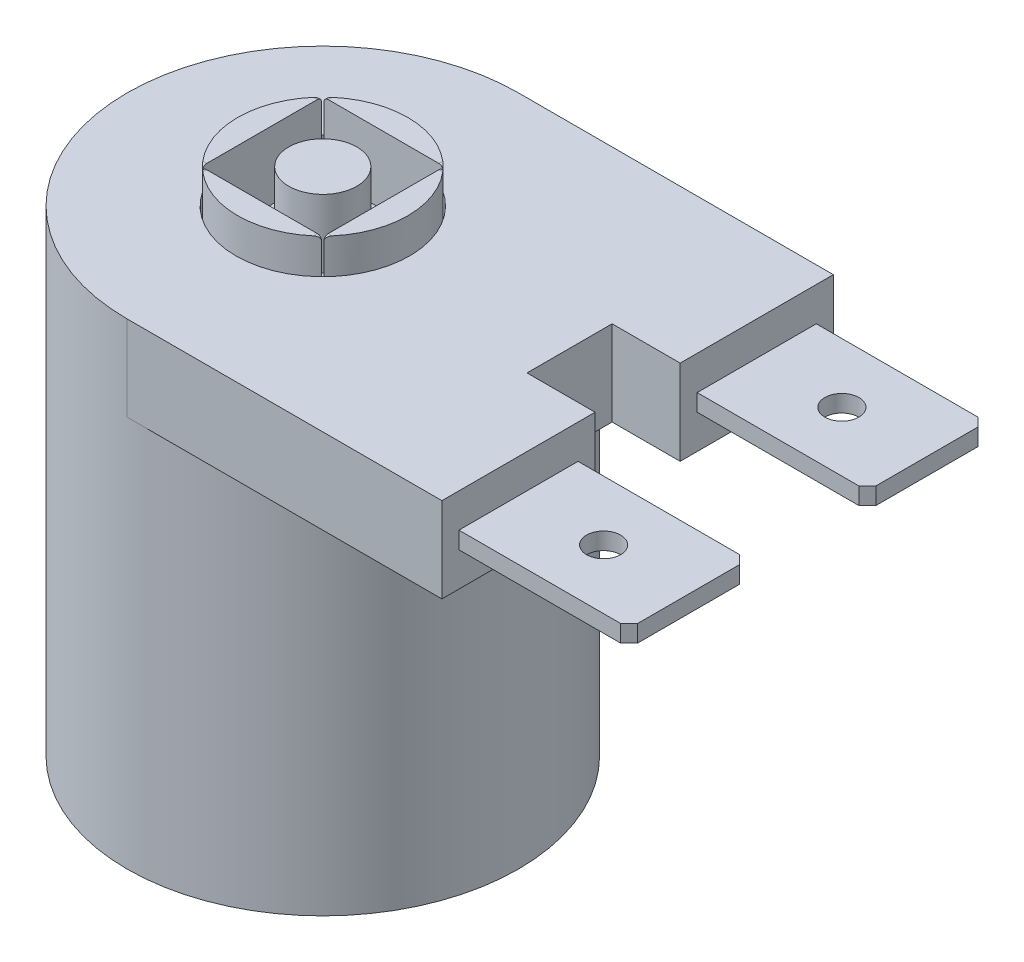
from build123d import *

# Parameters (mm, degrees)
SKETCH_1_R               = 11.5
EXTRUDE_1_DEPTH          = 28
EXTRUDE_START            = -5
EXTRUDE_2_DEPTH          = 5
SKETCH_3_W               = 7
SKETCH_3_H               = 1
EXTRUDE_3_DEPTH          = 10
CHAMFER_1_SIZE           = 0.5
SKETCH_4_R               = 1
CUT_EXTRUDE_1_DEPTH      = 9
SKETCH_5_R               = 5.1
CUT_EXTRUDE_3_DEPTH      = 2
SKETCH_7_R               = 2
EXTRUDE_5_DEPTH          = 4
CUT_EXTRUDE_4_DEPTH      = 24
CUT_EXTRUDE_4_DEPTH_BACK = 4
CUT_EXTRUDE_5_DEPTH      = 24
CUT_EXTRUDE_5_DEPTH_BACK = 4


with BuildPart() as part:
    # Эскиз1 → Бобышка-Вытянуть1 (new body)
    with BuildSketch(Plane(origin=(0, 0, 0), x_dir=(1, 0, 0), z_dir=(0, 1, 0))):
        with Locations(Location((0, 0, 0), (0, 0, 270))):
            Circle(SKETCH_1_R)
    extrude(amount=EXTRUDE_1_DEPTH)

    # Эскиз2 → Бобышка-Вытянуть2 (add)
    with BuildSketch(Plane(origin=(0, 28, 0), x_dir=(1, 0, 0), z_dir=(0, 1, 0)).offset(EXTRUDE_START)):
        with BuildLine():
            Line((0, 11.5), (18.5, 11.5))
            Line((18.5, 11.5), (18.5, 2.5))
            Line((18.5, 2.5), (14.5, 2.5))
            Line((14.5, 2.5), (14.5, -2.5))
            Line((14.5, -2.5), (18.5, -2.5))
            Line((18.5, -2.5), (18.5, -11.5))
            Line((18.5, -11.5), (0, -11.5))
            ThreePointArc((0, -11.5), (11.5, 0), (0, 11.5))
        make_face()
    extrude(amount=EXTRUDE_2_DEPTH)

    # Эскиз3 → Бобышка-Вытянуть3 (add)
    with BuildSketch(Plane(origin=(18.5, 0, 0), x_dir=(0, 0, -1), z_dir=(1, 0, 0))):
        with Locations((-7, 25.5)):
            Rectangle(SKETCH_3_W, SKETCH_3_H)
        with Locations((7, 25.5)):
            Rectangle(SKETCH_3_W, SKETCH_3_H)
    extrude(amount=EXTRUDE_3_DEPTH)

    # Фаска1
    chamfer_1_edges = [part.edges().sort_by_distance(p)[0] for p in [
        (28.5, 25.5, 10.5),
        (28.5, 25.5, 3.5),
        (28.5, 25.5, -10.5),
        (28.5, 25.5, -3.5),
    ]]
    chamfer(chamfer_1_edges, length=CHAMFER_1_SIZE)

    # Эскиз4 → Вырез-Вытянуть1 (cut)
    with BuildSketch(Plane(origin=(0, 26, 0), x_dir=(1, 0, 0), z_dir=(0, 1, 0))):
        with Locations(Location((23.5, -7, 0), (0, 0, 270))):
            Circle(SKETCH_4_R)
        with Locations(Location((23.5, 7, 0), (0, 0, 270))):
            Circle(SKETCH_4_R)
    extrude(amount=-CUT_EXTRUDE_1_DEPTH, mode=Mode.SUBTRACT)

    # Эскиз5 → Вырез-Вытянуть3 (cut)
    with BuildSketch(Plane(origin=(0, 28, 0), x_dir=(1, 0, 0), z_dir=(0, 1, 0))):
        with Locations(Location((0, 0, 0), (0, 0, 270))):
            Circle(SKETCH_5_R)
    extrude(amount=-CUT_EXTRUDE_3_DEPTH, mode=Mode.SUBTRACT)

    # Эскиз7 → Бобышка-Вытянуть5 (add)
    with BuildSketch(Plane(origin=(0, 26, 0), x_dir=(1, 0, 0), z_dir=(0, 1, 0))):
        with Locations(Location((0, 0, 0), (0, 0, 270))):
            Circle(SKETCH_7_R)
        with BuildLine():
            Line((-3.570714214, 3.5), (-3.570714214, -3.5))
            ThreePointArc((-3.570714214, -3.5), (-5, 0), (-3.570714214, 3.5))
        make_face()
        with BuildLine():
            Line((3.5, 3.570714214), (-3.5, 3.570714214))
            ThreePointArc((-3.5, 3.570714214), (0, 5), (3.5, 3.570714214))
        make_face()
        with BuildLine():
            Line((3.570714214, -3.5), (3.570714214, 3.5))
            ThreePointArc((3.570714214, 3.5), (5, 0), (3.570714214, -3.5))
        make_face()
        with BuildLine():
            Line((-3.5, -3.570714214), (3.5, -3.570714214))
            ThreePointArc((3.5, -3.570714214), (0, -5), (-3.5, -3.570714214))
        make_face()
    extrude(amount=EXTRUDE_5_DEPTH)

    # Эскиз8 → Вырез-Вытянуть4 (cut, two sides: drawn at the far end of the back side and taken through both)
    with BuildSketch(Plane.ZY.offset(-3.570714214).offset(-CUT_EXTRUDE_4_DEPTH_BACK)):
        with BuildLine():
            Line((-3.5, 30), (-3.5, 29.75))
            ThreePointArc((-3.5, 29.75), (-3.426776695, 29.926776695), (-3.25, 30))
            Line((-3.25, 30), (-3.5, 30))
        make_face()
        with BuildLine():
            Line((3.25, 30), (3.5, 30))
            Line((3.5, 30), (3.5, 29.75))
            ThreePointArc((3.5, 29.75), (3.426776695, 29.926776695), (3.25, 30))
        make_face()
    extrude(amount=CUT_EXTRUDE_4_DEPTH + CUT_EXTRUDE_4_DEPTH_BACK, mode=Mode.SUBTRACT)

    # Эскиз9 → Вырез-Вытянуть5 (cut, two sides: drawn at the far end of the back side and taken through both)
    with BuildSketch(Plane.XY.offset(-3.570714214).offset(-CUT_EXTRUDE_5_DEPTH_BACK)):
        with BuildLine():
            Line((-3.5, 30), (-3.5, 29.75))
            ThreePointArc((-3.5, 29.75), (-3.426776695, 29.926776695), (-3.25, 30))
            Line((-3.25, 30), (-3.5, 30))
        make_face()
        with BuildLine():
            Line((3.25, 30), (3.5, 30))
            Line((3.5, 30), (3.5, 29.75))
            ThreePointArc((3.5, 29.75), (3.426776695, 29.926776695), (3.25, 30))
        make_face()
    extrude(amount=CUT_EXTRUDE_5_DEPTH + CUT_EXTRUDE_5_DEPTH_BACK, mode=Mode.SUBTRACT)


solid = part.part
